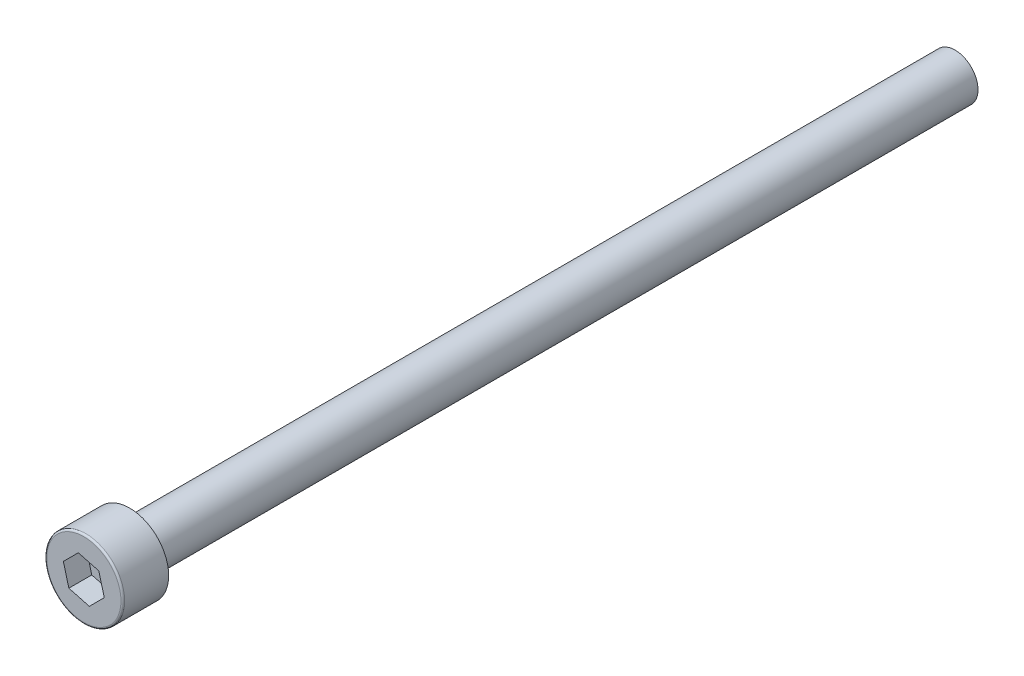
from build123d import *

# Parameters (mm, degrees)
SKETCH_1_R          = 4.25
EXTRUDE_1_DEPTH     = 5
CUT_EXTRUDE_1_DEPTH = 2.5
SKETCH_3_R          = 2.5
EXTRUDE_2_DEPTH     = 90
FILLET_1_R          = 0.2


with BuildPart() as part:
    # 草图1 → 凸台-拉伸1 (new body)
    with BuildSketch(Plane.XY):
        Circle(SKETCH_1_R)
    extrude(amount=EXTRUDE_1_DEPTH)

    # 草图2 → 切除-拉伸1 (cut)
    with BuildSketch(Plane.XY.offset(5)):
        Polygon((-1.632993162, -1.632993162), (0.597716981, -2.230710143), (2.230710143, -0.597716981), (1.632993162, 1.632993162), (-0.597716981, 2.230710143), (-2.230710143, 0.597716981), align=None)
    extrude(amount=-CUT_EXTRUDE_1_DEPTH, mode=Mode.SUBTRACT)

    # 草图3 → 凸台-拉伸2 (add)
    with BuildSketch(Plane(origin=(0, 0, 0), x_dir=(-1, 0, 0), z_dir=(0, 0, -1))):
        with Locations(Location((0, 0, 0), (0, 0, 180))):
            Circle(SKETCH_3_R)
    extrude(amount=EXTRUDE_2_DEPTH)

    # 圆角1
    fillet_1_edges = [part.edges().sort_by_distance(p)[0] for p in [
        (-4.25, 0, 5),
    ]]
    fillet(fillet_1_edges, radius=FILLET_1_R)


solid = part.part
